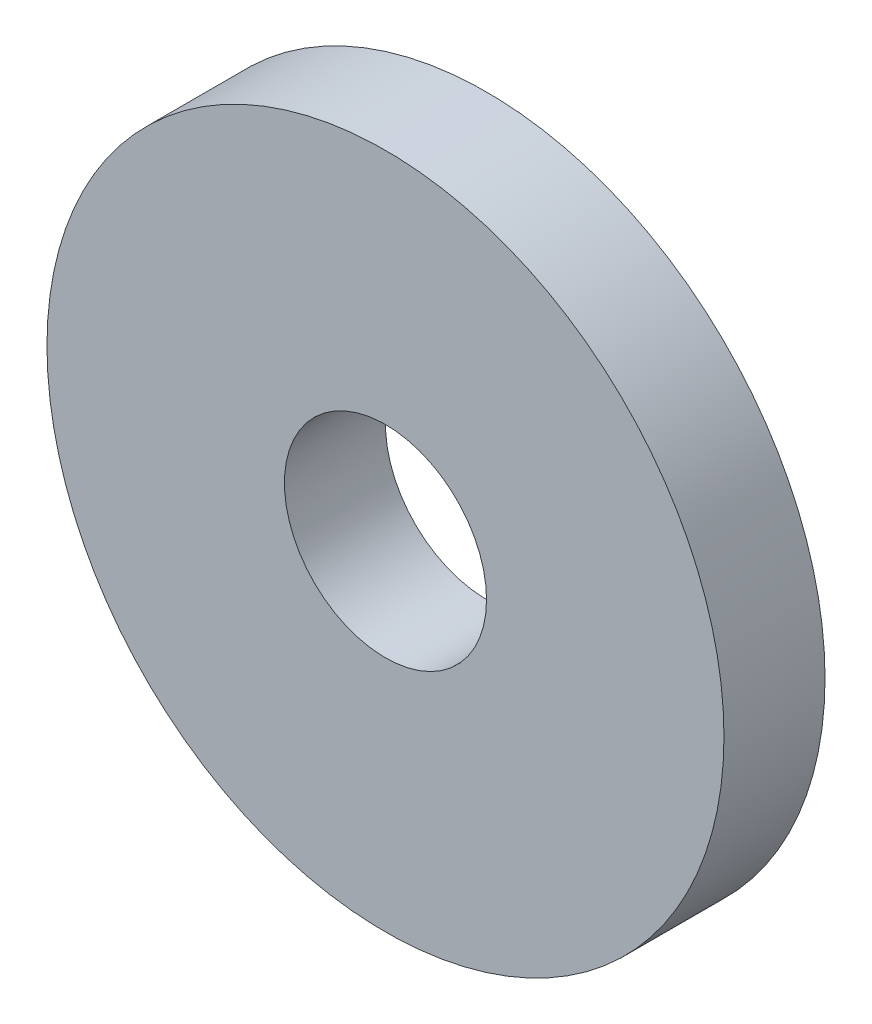
from build123d import *

# Parameters (mm, degrees)
SKETCH1_R           = 10.049875621
SKETCH1_R_2         = 3
BOSS_EXTRUDE1_DEPTH = 3


with BuildPart() as part:
    # Sketch1 → Boss-Extrude1 (new body)
    with BuildSketch(Plane.XY):
        with Locations((0.57738265, 0.096230442)):
            Circle(SKETCH1_R)
        with Locations((0.57738265, 0.096230442)):
            Circle(SKETCH1_R_2, mode=Mode.SUBTRACT)
    extrude(amount=BOSS_EXTRUDE1_DEPTH)


solid = part.part
